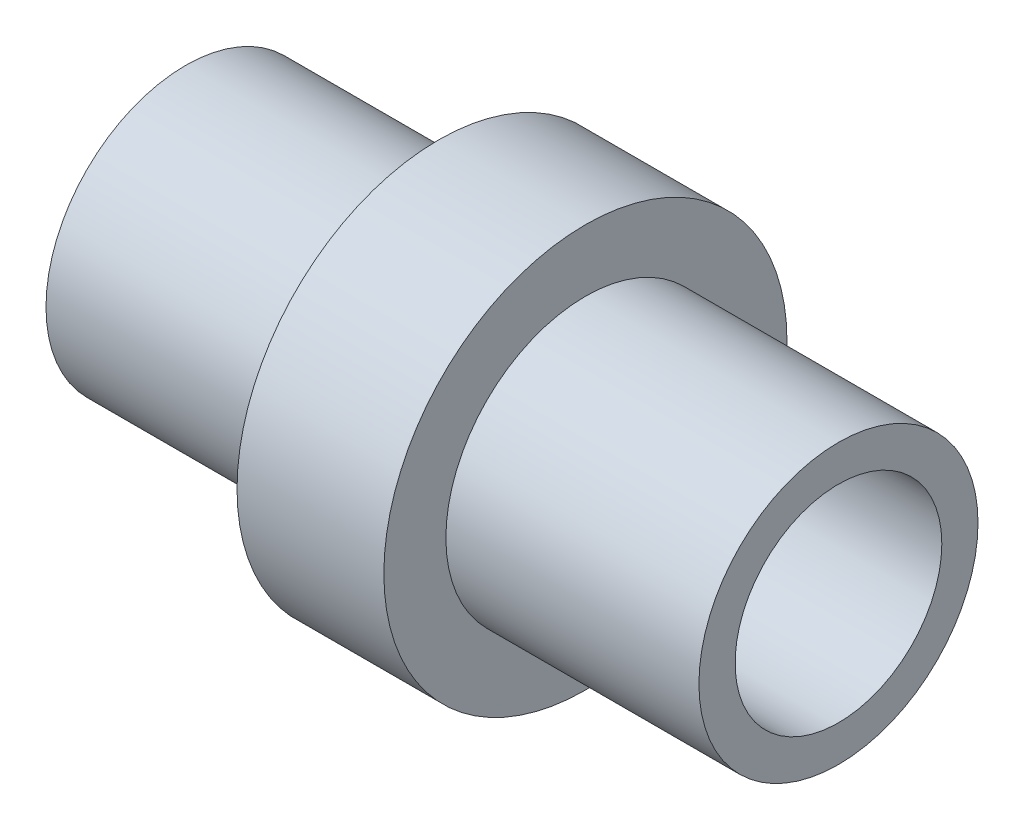
from build123d import *

# Parameters (mm, degrees)
CUT_EXTRUDE1_DEPTH      = 44.767370257
CUT_EXTRUDE1_DEPTH_BACK = 44.767370257
SKETCH3_R               = 6.35


with BuildPart() as part:
    # Sketch2 → Revolve1 (revolve)
    with BuildSketch(Plane(origin=(0, 0, 0), x_dir=(1, 0, 0), z_dir=(0, 1, 0))):
        Polygon((-20.055735381, 8.5725), (-4.510240996, 8.5725), (-4.510240996, 12.3825), (4.510240996, 12.3825), (4.510240996, 8.5725), (20.055735381, 8.5725), (20.055735381, 0), (-20.055735381, 0), align=None)
    revolve(axis=Axis((20.055735381, 0, 0), (-1, 0, 0)))

    # Sketch3 → Cut-Extrude1 (cut, two sides: drawn at the far end of the back side and taken through both)
    with BuildSketch(Plane(origin=(20.055735381, 0, 0), x_dir=(0, 0, -1), z_dir=(1, 0, 0)).offset(-CUT_EXTRUDE1_DEPTH_BACK)):
        Circle(SKETCH3_R)
    extrude(amount=CUT_EXTRUDE1_DEPTH + CUT_EXTRUDE1_DEPTH_BACK, mode=Mode.SUBTRACT)


solid = part.part
